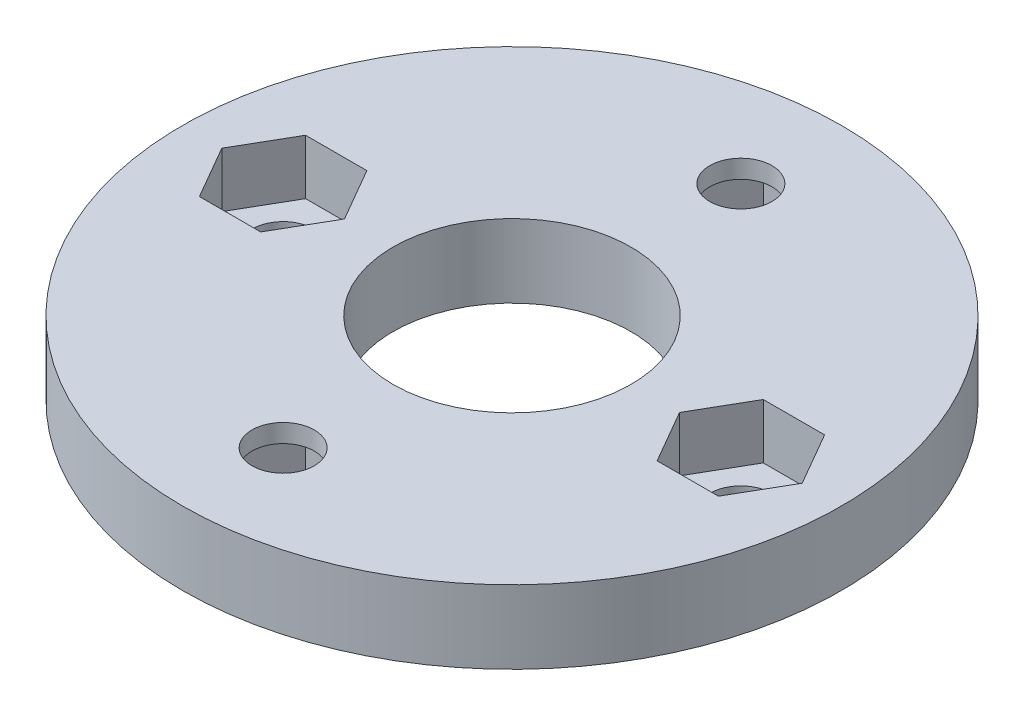
from build123d import *

# Parameters (mm, degrees)
SKETCH_1_R               = 18
SKETCH_1_R_2             = 6.5
EXTRUDE_366_DEPTH        = 4
CUT_EXTRUDE_589_DEPTH    = 3
SKETCH_3_R               = 1.7
CUT_EXTRUDE_770_DEPTH    = 26.632011236
PATTERN_CIRCULAR_1_COUNT = 4
CUT_EXTRUDE_1506_DEPTH   = 3


with BuildPart() as part:
    # Эскиз1 → Extrude 366 (new body)
    with BuildSketch(Plane(origin=(0, 0, 0), x_dir=(1, 0, 0), z_dir=(0, 1, 0))):
        with Locations(Location((0, 0, 0), (0, 0, 270))):
            Circle(SKETCH_1_R)
        with Locations(Location((0, 0, 0), (0, 0, 270))):
            Circle(SKETCH_1_R_2, mode=Mode.SUBTRACT)
    extrude(amount=EXTRUDE_366_DEPTH)

    # Эскиз2 → Cut-Extrude 589 (cut)
    with BuildSketch(Plane(origin=(0, 4, 0), x_dir=(1, 0, 0), z_dir=(0, 1, 0))):
        Polygon((-15.848631561, -2.23e-07), (-14.174315588, -2.900000111), (-10.825684027, -2.899999889), (-9.151368439, 2.23e-07), (-10.825684412, 2.900000111), (-14.174315973, 2.899999889), align=None)
        Polygon((15.848631561, -8.31e-07), (14.174315781, 2.899999169), (10.825684219, 2.899999169), (9.151368439, -8.31e-07), (10.825684219, -2.900000831), (14.174315781, -2.900000831), align=None)
    extrude(amount=-CUT_EXTRUDE_589_DEPTH, mode=Mode.SUBTRACT)

    # Эскиз3 → Cut-Extrude 770 (cut, symmetric)
    with BuildSketch(Plane(origin=(0, 1, 0), x_dir=(1, 0, 0), z_dir=(0, 1, 0))):
        with Locations(Location((12.5, 0, 0), (0, 0, 270))):
            Circle(SKETCH_3_R)
    cut_extrude_770 = extrude(amount=CUT_EXTRUDE_770_DEPTH, both=True, mode=Mode.SUBTRACT)

    # Круговой массив1: Cut-Extrude 770 ×4 about axis
    pattern_circular_1_axis = Axis((0, 0, 0), (0, 1, 0))
    for i in range(1, PATTERN_CIRCULAR_1_COUNT):
        add(cut_extrude_770.rotate(pattern_circular_1_axis, i * 360 / PATTERN_CIRCULAR_1_COUNT), mode=Mode.SUBTRACT)

    # Эскиз5 → Cut-Extrude 1506 (cut)
    with BuildSketch(Plane.XZ):
        Polygon((3.348631561, 12.5), (1.674315781, 15.4), (-1.674315781, 15.4), (-3.348631561, 12.5), (-1.674315781, 9.6), (1.674315781, 9.6), align=None)
        Polygon((-3.348631561, -12.5), (-1.674315781, -15.4), (1.674315781, -15.4), (3.348631561, -12.5), (1.674315781, -9.6), (-1.674315781, -9.6), align=None)
    extrude(amount=-CUT_EXTRUDE_1506_DEPTH, mode=Mode.SUBTRACT)


solid = part.part
